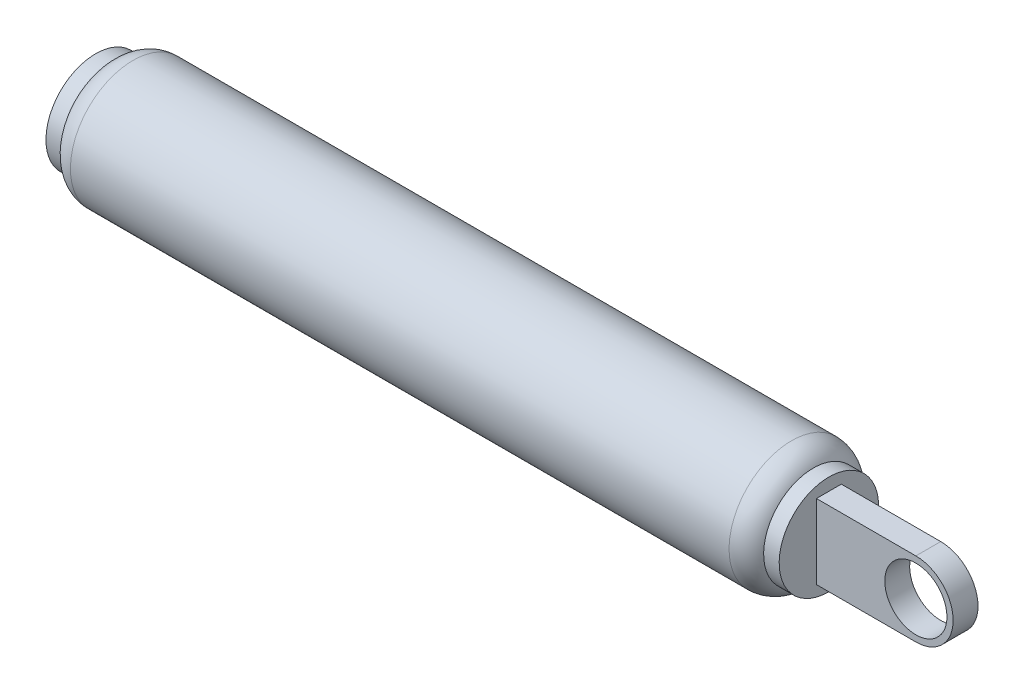
from build123d import *

# Parameters (mm, degrees)
BOSS_EXTRUDE1_DEPTH          = 2
F_6_0_6_DIAMETER_HOLE1_D     = 6
F_6_0_6_DIAMETER_HOLE1_DEPTH = 25
F_5_0_5_DIAMETER_HOLE1_D     = 5
F_5_0_5_DIAMETER_HOLE1_DEPTH = 6.031754163


with BuildPart() as part:
    # Sketch1 → Revolve1 (revolve)
    with BuildSketch(Plane(origin=(0, 0, 0), x_dir=(-1, 0, 0), z_dir=(0, 0, -1))):
        with BuildLine():
            Line((-29.5, 4), (-29.5, 0))
            Line((-29.5, 0), (29.5, 0))
            Line((29.5, 0), (29.5, 4))
            Line((29.5, 4), (28.25, 4))
            ThreePointArc((28.25, 4), (27.515753003, 4.754613948), (26.5, 5.031754163))
            Line((26.5, 5.031754163), (-26.5, 5.031754163))
            ThreePointArc((-26.5, 5.031754163), (-27.515753003, 4.754613948), (-28.25, 4))
            Line((-28.25, 4), (-29.5, 4))
        make_face()
    revolve(axis=Axis((29.5, 0, 0), (-1, 0, 0)))

    # Sketch2 → Boss-Extrude1 (add)
    with BuildSketch(Plane.XY.offset(1)):
        with BuildLine():
            Line((37.5, 3), (29.5, 3))
            Line((29.5, 3), (29.5, -3))
            Line((29.5, -3), (37.5, -3))
            ThreePointArc((37.5, -3), (40.5, 0), (37.5, 3))
        make_face()
    extrude(amount=-BOSS_EXTRUDE1_DEPTH)

    # Ø6.0 (6) Diameter Hole1
    with Locations(Plane.ZY.offset(29.5)):
        with Locations((0, 0)):
            Hole(F_6_0_6_DIAMETER_HOLE1_D / 2, depth=F_6_0_6_DIAMETER_HOLE1_DEPTH)

    # Ø5.0 (5) Diameter Hole1
    with Locations(Plane(origin=(0, 0, -1), x_dir=(-1, 0, 0), z_dir=(0, 0, -1))):
        with Locations((-37.5, 0)):
            Hole(F_5_0_5_DIAMETER_HOLE1_D / 2, depth=F_5_0_5_DIAMETER_HOLE1_DEPTH)


solid = part.part
